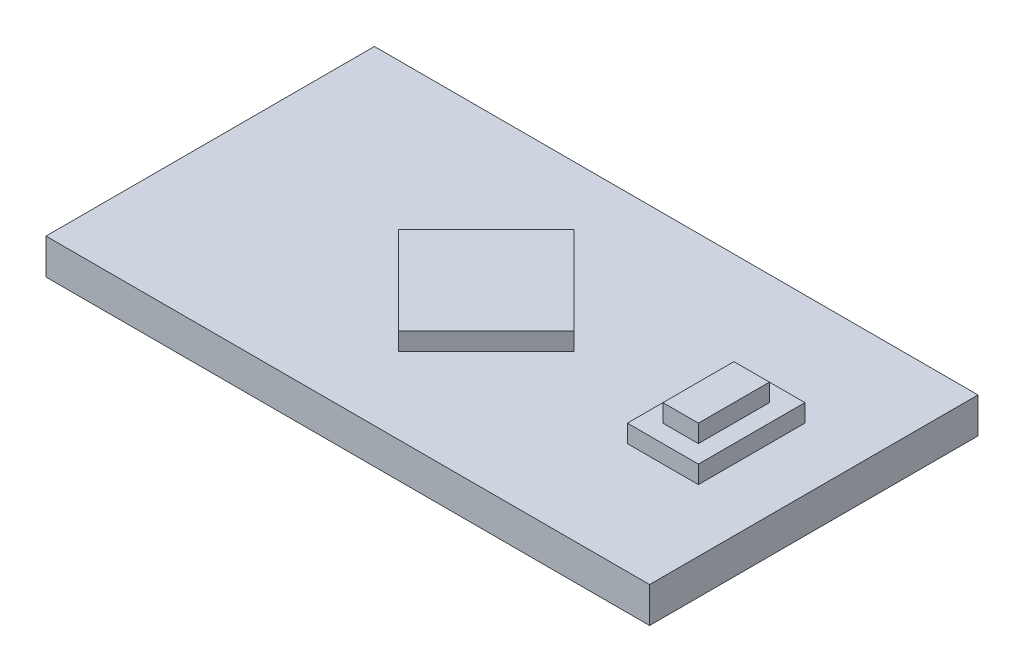
from build123d import *

# Parameters (mm, degrees)
SKETCH1_W           = 34
SKETCH1_H           = 18.5
BOSS_EXTRUDE1_DEPTH = 2
SKETCH2_W           = 4
SKETCH2_H           = 6
BOSS_EXTRUDE2_DEPTH = 1
SKETCH3_W           = 2
SKETCH3_H           = 4
BOSS_EXTRUDE3_DEPTH = 1
BOSS_EXTRUDE4_DEPTH = 1


with BuildPart() as part:
    # Sketch1 → Boss-Extrude1 (new body)
    with BuildSketch(Plane(origin=(0, 0, 0), x_dir=(1, 0, 0), z_dir=(0, 1, 0))):
        Rectangle(SKETCH1_W, SKETCH1_H)
    extrude(amount=BOSS_EXTRUDE1_DEPTH)

    # Sketch2 → Boss-Extrude2 (add)
    with BuildSketch(Plane(origin=(0, 2, 0), x_dir=(1, 0, 0), z_dir=(0, 1, 0))):
        with Locations((11.5, 0)):
            Rectangle(SKETCH2_W, SKETCH2_H)
    extrude(amount=BOSS_EXTRUDE2_DEPTH)

    # Sketch3 → Boss-Extrude3 (add)
    with BuildSketch(Plane(origin=(0, 3, 0), x_dir=(1, 0, 0), z_dir=(0, 1, 0))):
        with Locations((11.5, 0)):
            Rectangle(SKETCH3_W, SKETCH3_H)
    extrude(amount=BOSS_EXTRUDE3_DEPTH)

    # Sketch4 → Boss-Extrude4 (add)
    with BuildSketch(Plane(origin=(0, 2, 0), x_dir=(1, 0, 0), z_dir=(0, 1, 0))):
        Polygon((3.5, 0), (-1.449747468, 4.949747468), (-6.399494937, 0), (-1.449747468, -4.949747468), align=None)
    extrude(amount=BOSS_EXTRUDE4_DEPTH)


solid = part.part
